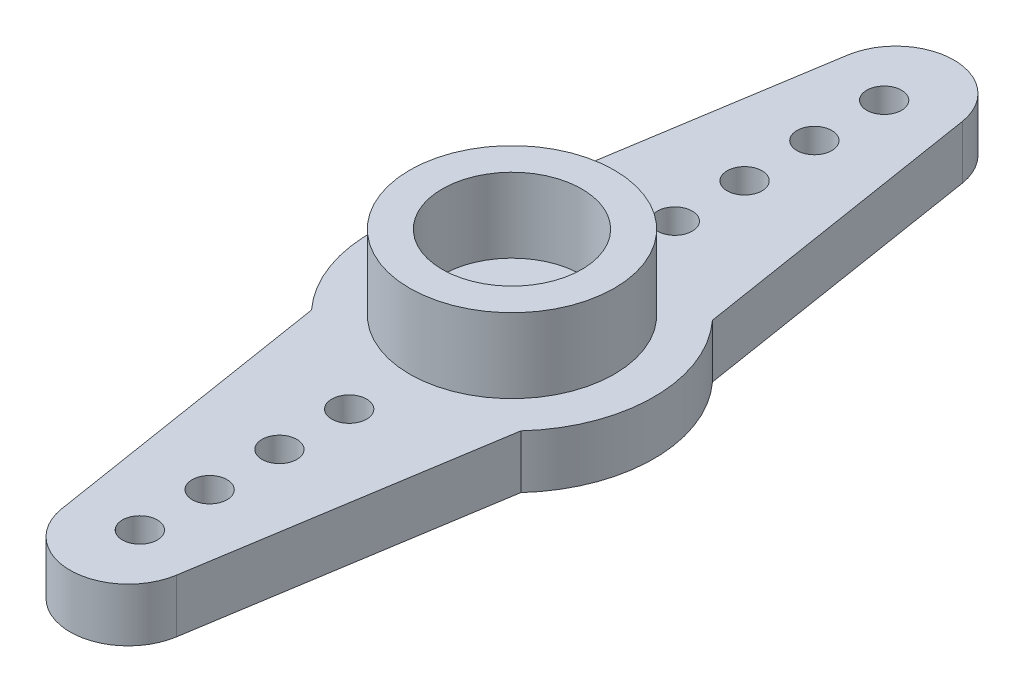
from build123d import *

# Parameters (mm, degrees)
SKETCH1_R           = 6.1
SKETCH1_R_2         = 1.5
BOSS_EXTRUDE1_DEPTH = 2.3
SKETCH2_R           = 4.4
SKETCH2_R_2         = 3
BOSS_EXTRUDE2_DEPTH = 3.2
BOSS_EXTRUDE3_DEPTH = 2.3
CIRPATTERN1_COUNT   = 2


with BuildPart() as part:
    # Sketch1 → Boss-Extrude1 (new body)
    with BuildSketch(Plane(origin=(0, 0, 0), x_dir=(1, 0, 0), z_dir=(0, 1, 0))):
        with Locations(Location((0, 0, 0), (0, 0, 270))):
            Circle(SKETCH1_R)
        with Locations(Location((0, 0, 0), (0, 0, 270))):
            Circle(SKETCH1_R_2, mode=Mode.SUBTRACT)
    extrude(amount=BOSS_EXTRUDE1_DEPTH)

    # Sketch2 → Boss-Extrude2 (add)
    with BuildSketch(Plane(origin=(0, 2.3, 0), x_dir=(1, 0, 0), z_dir=(0, 1, 0))):
        with Locations(Location((0, 0, 0), (0, 0, 270))):
            Circle(SKETCH2_R)
        with Locations(Location((0, 0, 0), (0, 0, 270))):
            Circle(SKETCH2_R_2, mode=Mode.SUBTRACT)
    extrude(amount=BOSS_EXTRUDE2_DEPTH)

    # Sketch3 → Boss-Extrude3 (add)
    with BuildSketch(Plane.XZ):
        with BuildLine():
            ThreePointArc((4.5, -4.118252056), (2.458522163, -5.582622034), (0, -6.1))
            Line((0, -6.1), (0, -6.25))
            ThreePointArc((0, -6.25), (0.530330086, -6.469669914), (0.75, -7))
            ThreePointArc((0.75, -7), (0.530330086, -7.530330086), (0, -7.75))
            Line((0, -7.75), (0, -9.25))
            ThreePointArc((0, -9.25), (0.530330086, -9.469669914), (0.75, -10))
            ThreePointArc((0.75, -10), (0.530330086, -10.530330086), (0, -10.75))
            Line((0, -10.75), (0, -12.25))
            ThreePointArc((0, -12.25), (0.530330086, -12.469669914), (0.75, -13))
            ThreePointArc((0.75, -13), (0.530330086, -13.530330086), (0, -13.75))
            Line((0, -13.75), (0, -15.25))
            ThreePointArc((0, -15.25), (0.530330086, -15.469669914), (0.75, -16))
            ThreePointArc((0.75, -16), (0.530330086, -16.530330086), (0, -16.75))
            Line((0, -16.75), (0, -19))
            ThreePointArc((0, -19), (1.623056726, -18.401495955), (2.468988638, -16.892549493))
            Line((2.468988638, -16.892549493), (4.5, -4.118252056))
        make_face()
        with BuildLine():
            Line((0, -6.25), (0, -6.1))
            ThreePointArc((0, -6.1), (-2.458522163, -5.582622034), (-4.5, -4.118252056))
            Line((-4.5, -4.118252056), (-2.468988638, -16.892549493))
            ThreePointArc((-2.468988638, -16.892549493), (-1.623056726, -18.401495955), (0, -19))
            Line((0, -19), (0, -16.75))
            ThreePointArc((0, -16.75), (-0.75, -16), (0, -15.25))
            Line((0, -15.25), (0, -13.75))
            ThreePointArc((0, -13.75), (-0.75, -13), (0, -12.25))
            Line((0, -12.25), (0, -10.75))
            ThreePointArc((0, -10.75), (-0.75, -10), (0, -9.25))
            Line((0, -9.25), (0, -7.75))
            ThreePointArc((0, -7.75), (-0.75, -7), (0, -6.25))
        make_face()
    boss_extrude3 = extrude(amount=-BOSS_EXTRUDE3_DEPTH)

    # CirPattern1: Boss-Extrude3 ×2 about axis
    cirpattern1_axis = Axis((0, 0, 0), (0, 1, 0))
    for i in range(1, CIRPATTERN1_COUNT):
        add(boss_extrude3.rotate(cirpattern1_axis, i * 360 / CIRPATTERN1_COUNT))


solid = part.part
